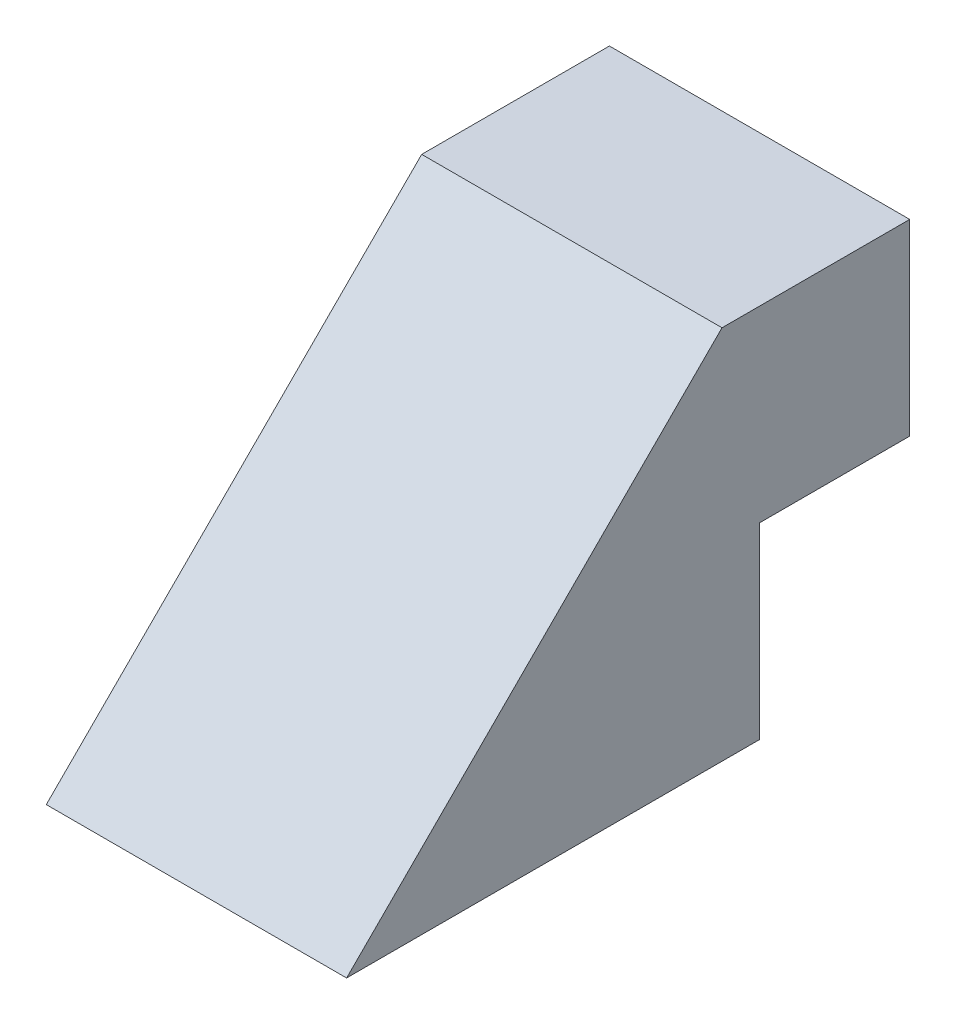
from build123d import *

# Parameters (mm, degrees)
SKETCH1_W           = 4
SKETCH1_H           = 0.5
BOSS_EXTRUDE1_DEPTH = 5
SKETCH2_W           = 4
SKETCH2_H           = 2.5
BOSS_EXTRUDE2_DEPTH = 2
BOSS_EXTRUDE4_DEPTH = 4


with BuildPart() as part:
    # Sketch1 → Boss-Extrude1 (new body)
    with BuildSketch(Plane(origin=(0, 0, 0), x_dir=(1, 0, 0), z_dir=(0, 1, 0))):
        with Locations((2, 0.25)):
            Rectangle(SKETCH1_W, SKETCH1_H)
    extrude(amount=BOSS_EXTRUDE1_DEPTH)

    # Sketch2 → Boss-Extrude2 (add)
    with BuildSketch(Plane(origin=(0, 0, -0.5), x_dir=(-1, 0, 0), z_dir=(0, 0, -1))):
        with Locations((-2, 3.75)):
            Rectangle(SKETCH2_W, SKETCH2_H)
    extrude(amount=BOSS_EXTRUDE2_DEPTH)

    # Sketch4 → Boss-Extrude4 (add)
    with BuildSketch(Plane.ZY):
        Polygon((0, 5), (0, 0), (5, 0), align=None)
    extrude(amount=-BOSS_EXTRUDE4_DEPTH)


solid = part.part
